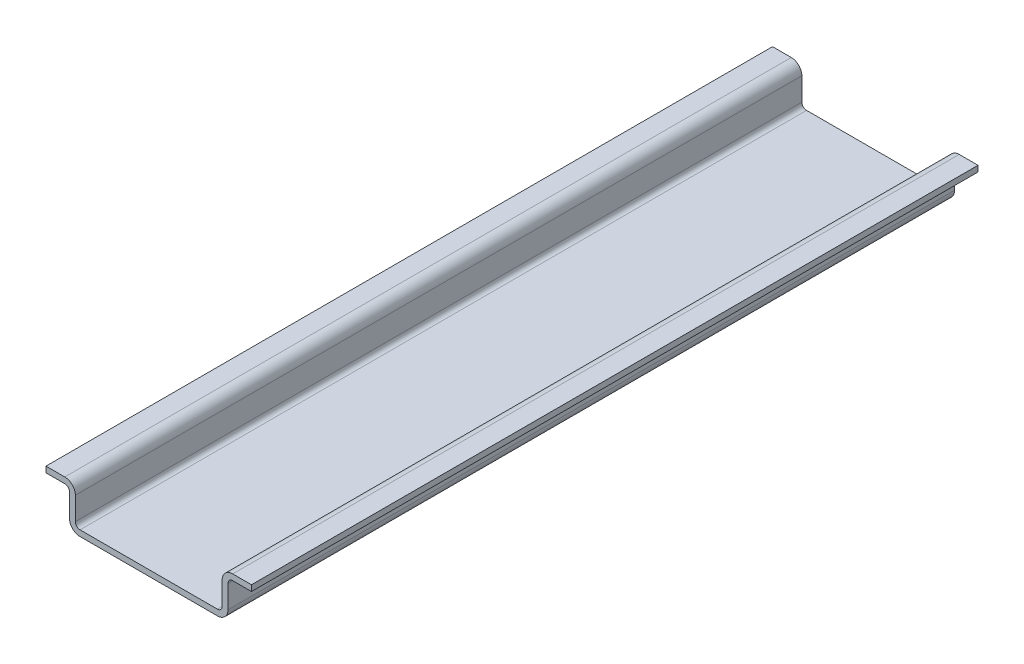
from build123d import *

# Parameters (mm, degrees)
DIN_RAIL_NS_35_7_5_PERF_2000MM_1_DEPTH = 123.75


with BuildPart() as part:
    # Sketch12 → Din_rail NS 35 7 5 PERF 2000MM(1) (new body)
    with BuildSketch(Plane(origin=(0, 0, 0), x_dir=(-1, 0, 0), z_dir=(0, 0, -1))):
        with BuildLine():
            Line((11.7, 0), (-11.7, 0))
            ThreePointArc((-11.7, 0), (-12.972792206, 0.527207794), (-13.5, 1.8))
            Line((-13.5, 1.8), (-13.5, 5.7))
            ThreePointArc((-13.5, 5.7), (-13.734314575, 6.265685425), (-14.3, 6.5))
            Line((-14.3, 6.5), (-17.5, 6.5))
            Line((-17.5, 6.5), (-17.5, 7.5))
            Line((-17.5, 7.5), (-14.3, 7.5))
            ThreePointArc((-14.3, 7.5), (-13.027207794, 6.972792206), (-12.5, 5.7))
            Line((-12.5, 5.7), (-12.5, 1.8))
            ThreePointArc((-12.5, 1.8), (-12.265685425, 1.234314575), (-11.7, 1))
            Line((-11.7, 1), (11.7, 1))
            ThreePointArc((11.7, 1), (12.265685425, 1.234314575), (12.5, 1.8))
            Line((12.5, 1.8), (12.5, 5.7))
            ThreePointArc((12.5, 5.7), (13.027207794, 6.972792206), (14.3, 7.5))
            Line((14.3, 7.5), (17.5, 7.5))
            Line((17.5, 7.5), (17.5, 6.5))
            Line((17.5, 6.5), (14.3, 6.5))
            ThreePointArc((14.3, 6.5), (13.734314575, 6.265685425), (13.5, 5.7))
            Line((13.5, 5.7), (13.5, 1.8))
            ThreePointArc((13.5, 1.8), (12.972792206, 0.527207794), (11.7, 0))
        make_face()
    extrude(amount=DIN_RAIL_NS_35_7_5_PERF_2000MM_1_DEPTH)


solid = part.part
